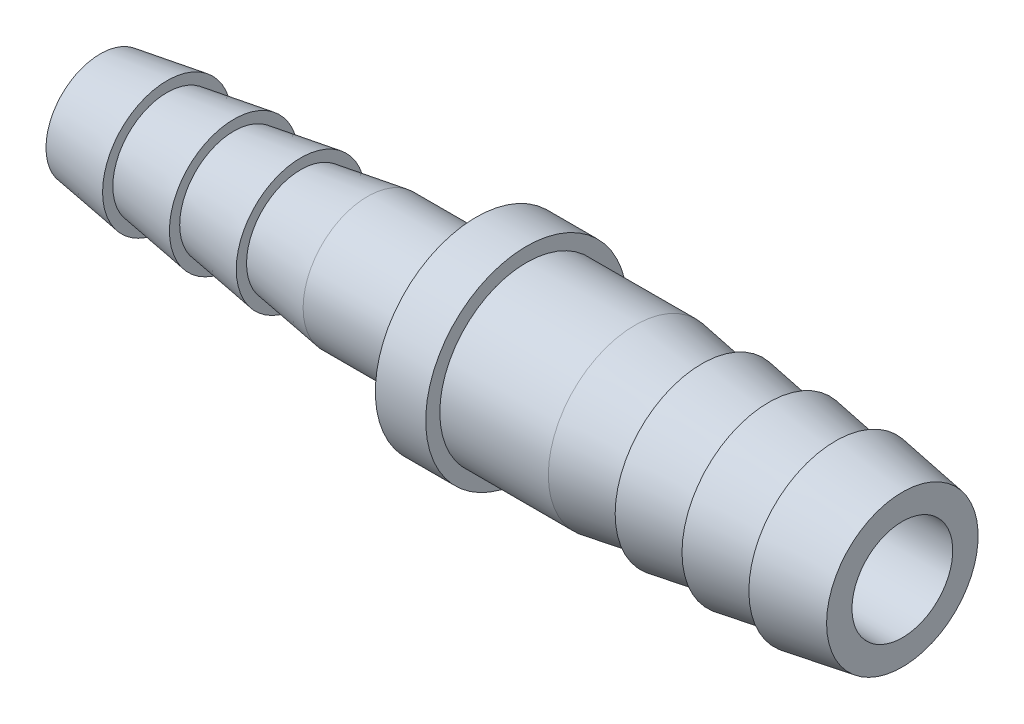
from build123d import *

# Parameters (mm, degrees)
SKETCH1_W       = 25.273
SKETCH1_H       = 2.159
SKETCH2_W       = 3.175
SKETCH2_H       = 4.445
LPATTERN1_COUNT = 4
LPATTERN1_PITCH = 4.212166667
SKETCH4_W       = 25.273
SKETCH4_H       = 2.286
LPATTERN2_COUNT = 4
LPATTERN2_PITCH = 4.212166667
SKETCH6_W       = 2.032
SKETCH6_H       = 1.27


with BuildPart() as part:
    # Sketch1 → Revolve1 (revolve)
    with BuildSketch(Plane.XY, mode=Mode.PRIVATE) as revolve1_sk:
        with Locations((-12.6365, 2.9845)):
            Rectangle(SKETCH1_W, SKETCH1_H)
    revolve(revolve1_sk.sketch.rotate(Axis((-25.273, 0, 0), (1, 0, 0)), 90), axis=Axis((-25.273, 0, 0), (1, 0, 0)))

    # Sketch2 → Revolve2 (revolve)
    with BuildSketch(Plane.XY, mode=Mode.PRIVATE) as revolve2_sk:
        with Locations((0, 4.1275)):
            Rectangle(SKETCH2_W, SKETCH2_H)
    revolve(revolve2_sk.sketch.rotate(Axis((0, 0, 0), (-1, 0, 0)), 270), axis=Axis((0, 0, 0), (-1, 0, 0)))

    # Sketch3 → Cut-Revolve1 (revolve, cut)
    with BuildSketch(Plane.XY, mode=Mode.PRIVATE) as cut_revolve1_sk:
        Polygon((-25.273, 4.064), (-25.273, 3.4163), (-21.060833333, 4.064), align=None)
    cut_revolve1 = revolve(cut_revolve1_sk.sketch.rotate(Axis((-25.273, 0, 0), (1, 0, 0)), 90), axis=Axis((-25.273, 0, 0), (1, 0, 0)), mode=Mode.SUBTRACT)

    # LPattern1: Cut-Revolve1 ×4
    with Locations(*[(i * LPATTERN1_PITCH, 0, 0) for i in range(1, LPATTERN1_COUNT)]):
        add(cut_revolve1, mode=Mode.SUBTRACT)



with BuildPart() as body_2:
    # Sketch4 → Revolve3 (revolve)
    with BuildSketch(Plane.XY, mode=Mode.PRIVATE) as revolve3_sk:
        with Locations((12.6365, 4.318)):
            Rectangle(SKETCH4_W, SKETCH4_H)
    revolve(revolve3_sk.sketch.rotate(Axis((0, 0, 0), (1, 0, 0)), 90), axis=Axis((0, 0, 0), (1, 0, 0)))

    # Sketch5 → Cut-Revolve2 (revolve, cut)
    with BuildSketch(Plane.XY, mode=Mode.PRIVATE) as cut_revolve2_sk:
        Polygon((25.273, 5.461), (25.273, 4.7752), (21.060833333, 5.461), align=None)
    cut_revolve2 = revolve(cut_revolve2_sk.sketch.rotate(Axis((-25.273, 0, 0), (1, 0, 0)), 90), axis=Axis((-25.273, 0, 0), (1, 0, 0)), mode=Mode.SUBTRACT)

    # LPattern2: Cut-Revolve2 ×4
    with Locations(*[(-i * LPATTERN2_PITCH, 0, 0) for i in range(1, LPATTERN2_COUNT)]):
        add(cut_revolve2, mode=Mode.SUBTRACT)


with BuildPart() as part_1:
    add(part.part)

    add(body_2.part)  # Revolve4 merges body 2
    # Sketch6 → Revolve4 (revolve)
    with BuildSketch(Plane.XY, mode=Mode.PRIVATE) as revolve4_sk:
        with Locations((1.016, 2.54)):
            Rectangle(SKETCH6_W, SKETCH6_H)
    revolve(revolve4_sk.sketch.rotate(Axis((-25.273, 0, 0), (1, 0, 0)), 90), axis=Axis((-25.273, 0, 0), (1, 0, 0)))


solid = part_1.part
